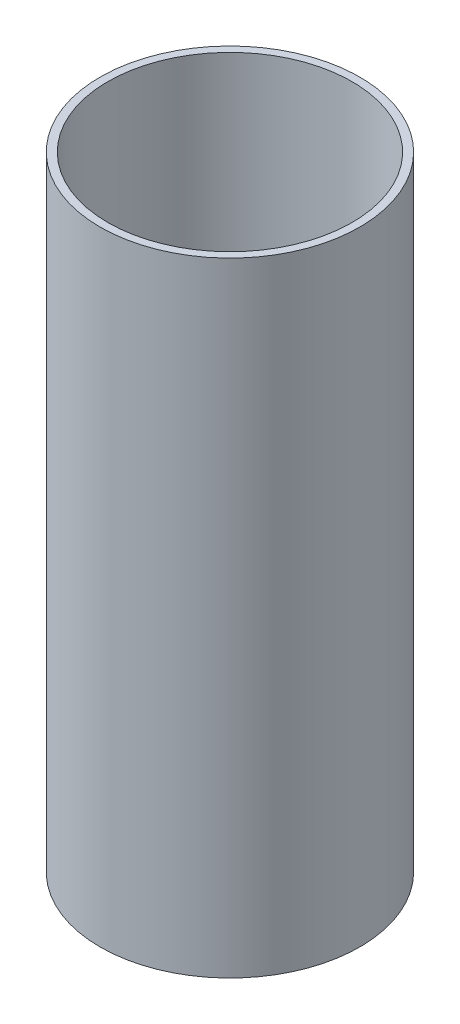
from build123d import *

# Parameters (mm, degrees)
SKETCH_1_R      = 25
SKETCH_1_R_2    = 23.5
EXTRUDE_1_DEPTH = 120


with BuildPart() as part:
    # 草图1 → 凸台-拉伸1 (new body)
    with BuildSketch(Plane(origin=(0, 0, 0), x_dir=(1, 0, 0), z_dir=(0, 1, 0))):
        with Locations(Location((0, 0, 0), (0, 0, 270))):
            Circle(SKETCH_1_R)
        with Locations(Location((0, 0, 0), (0, 0, 270))):
            Circle(SKETCH_1_R_2, mode=Mode.SUBTRACT)
    extrude(amount=EXTRUDE_1_DEPTH)


solid = part.part
